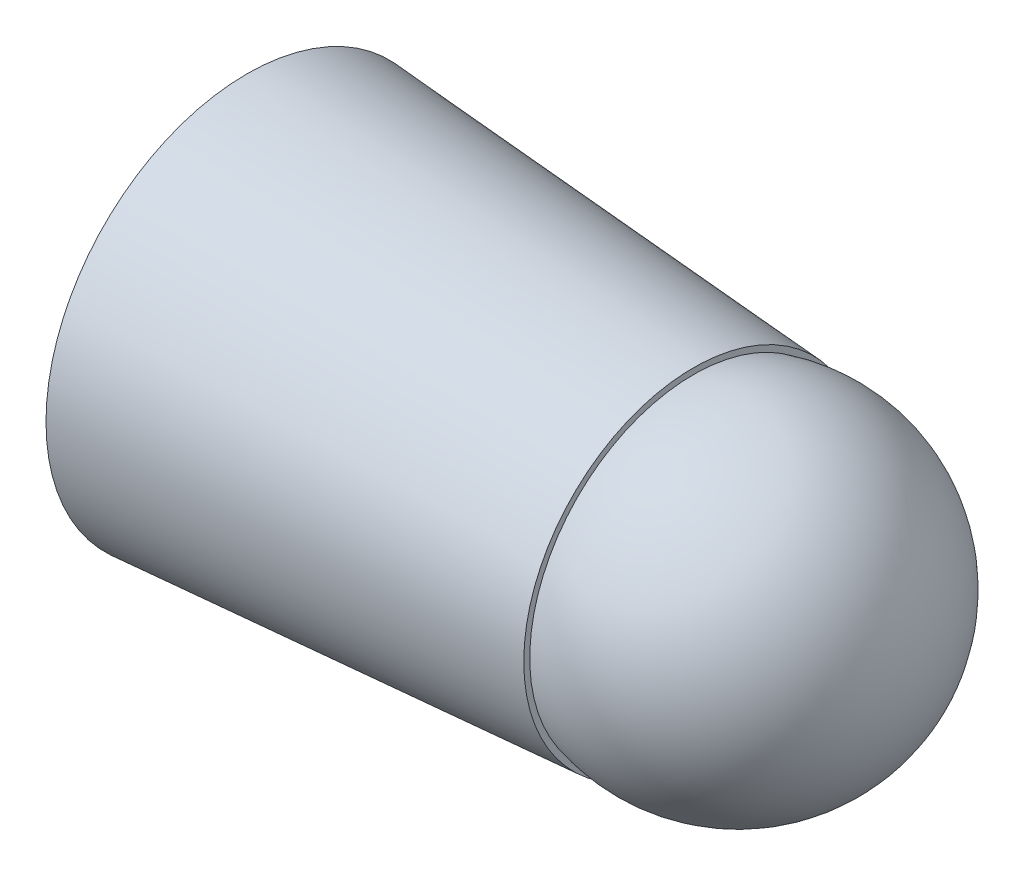
from build123d import *

# Parameters (mm, degrees)
SKETCH1_R           = 4.5
BOSS_EXTRUDE1_DEPTH = 10
BOSS_EXTRUDE1_TAPER = 4


with BuildPart() as part:
    # Sketch1 → Boss-Extrude1 (new body)
    with BuildSketch(Plane(origin=(0, 0, 0), x_dir=(0, 0, -1), z_dir=(1, 0, 0))):
        Circle(SKETCH1_R)
    extrude(amount=BOSS_EXTRUDE1_DEPTH, taper=BOSS_EXTRUDE1_TAPER)

    # Sketch2 → Revolve1 (revolve)
    with BuildSketch(Plane(origin=(11, 0, 0), x_dir=(0, 0, -1), z_dir=(1, 0, 0))):
        with BuildLine():
            Line((0, 3.800731881), (0, -3.800731881))
            ThreePointArc((0, -3.800731881), (3.800731881, 0), (0, 3.800731881))
        make_face()
    revolve(axis=Axis((11, 3.800731881, 0), (0, -1, 0)))


solid = part.part
